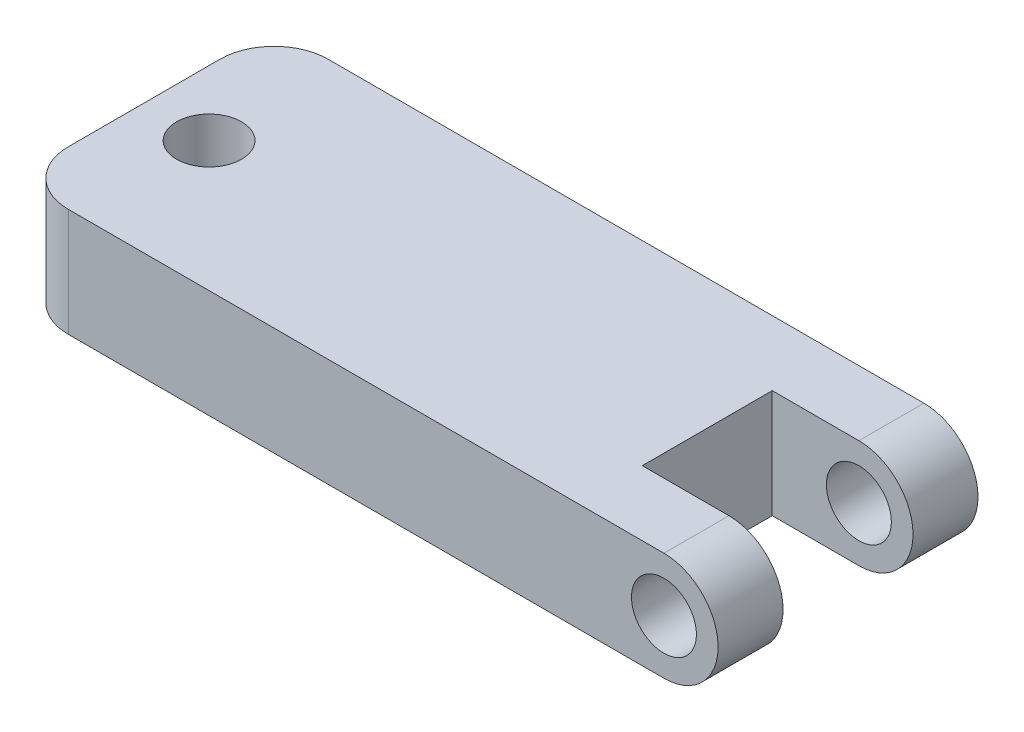
from build123d import *

# Parameters (mm, degrees)
BOSS_EXTRUDE1_DEPTH = 12
SKETCH2_W           = 6.5
SKETCH2_H           = 6
CUT_EXTRUDE1_DEPTH  = 36.003571246
SKETCH3_R           = 1.5
CUT_EXTRUDE2_DEPTH  = 12
SKETCH6_R           = 1.5
CUT_EXTRUDE3_DEPTH  = 36.003571246
FILLET1_R           = 2.5


with BuildPart() as part:
    # Sketch1 → Boss-Extrude1 (new body)
    with BuildSketch(Plane.XY):
        with BuildLine():
            Line((0, 0), (30, 0))
            ThreePointArc((30, 0), (32.5, 2.5), (30, 5))
            Line((30, 5), (0, 5))
            Line((0, 5), (0, 0))
        make_face()
    extrude(amount=-BOSS_EXTRUDE1_DEPTH)

    # Sketch2 → Cut-Extrude1 (cut, through all)
    with BuildSketch(Plane(origin=(0, 5, 0), x_dir=(1, 0, 0), z_dir=(0, 1, 0))):
        with Locations((29.25, 6)):
            Rectangle(SKETCH2_W, SKETCH2_H)
    extrude(amount=-CUT_EXTRUDE1_DEPTH, mode=Mode.SUBTRACT)

    # Sketch3 → Cut-Extrude2 (cut)
    with BuildSketch(Plane.XY):
        with Locations((30, 2.5)):
            Circle(SKETCH3_R)
    extrude(amount=-CUT_EXTRUDE2_DEPTH, mode=Mode.SUBTRACT)

    # Sketch6 → Cut-Extrude3 (cut, through all)
    with BuildSketch(Plane(origin=(0, 5, 0), x_dir=(1, 0, 0), z_dir=(0, 1, 0))):
        with Locations(Location((3, 6, 0), (0, 0, 270))):
            Circle(SKETCH6_R)
    extrude(amount=-CUT_EXTRUDE3_DEPTH, mode=Mode.SUBTRACT)

    # Fillet1
    fillet1_edges = [part.edges().sort_by_distance(p)[0] for p in [
        (0, 2.5, -12),
        (0, 2.5, 0),
    ]]
    fillet(fillet1_edges, radius=FILLET1_R)


solid = part.part
